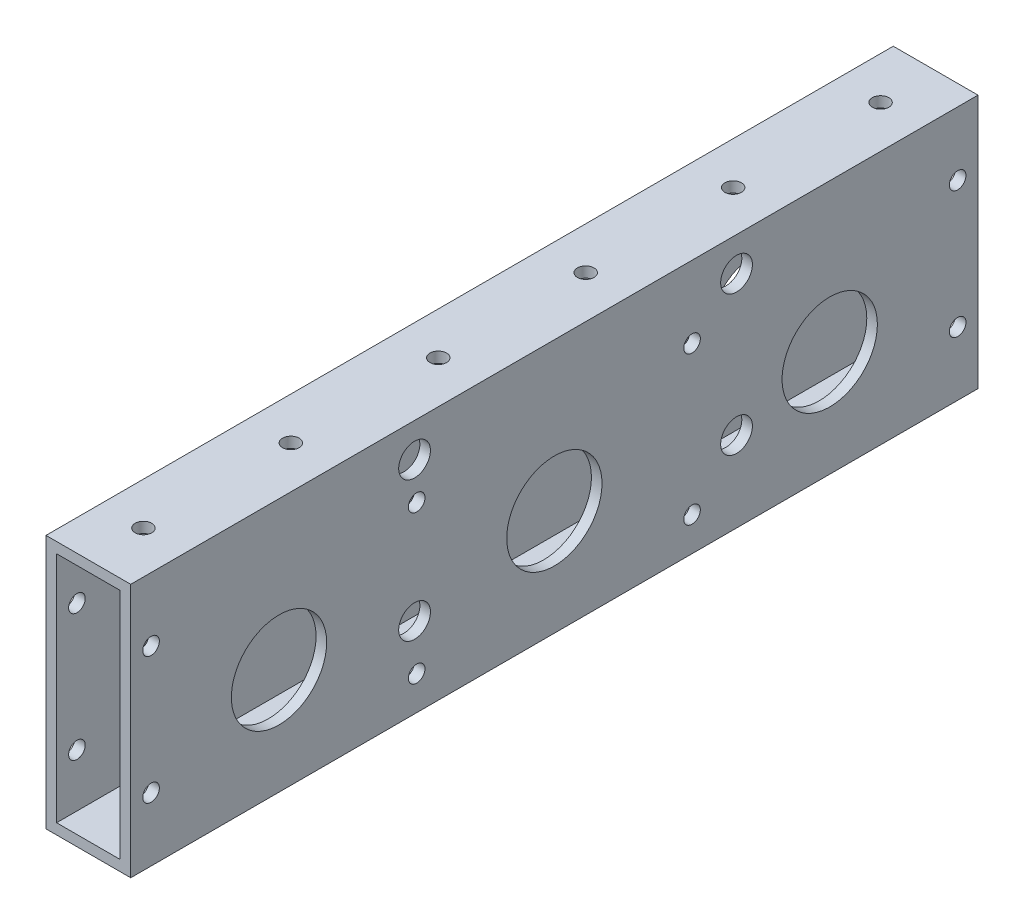
from build123d import *

# Parameters (mm, degrees)
SKETCH1_W                        = 254
SKETCH1_H                        = 76.2
BOSS_EXTRUDE1_DEPTH              = 25.4
SHELL1_T                         = -3.175
SKETCH2_R                        = 14.2875
CUT_EXTRUDE1_DEPTH               = 136.002851822
F_10_CLEARANCE_HOLE1_D           = 4.9784
F_10_CLEARANCE_HOLE2_D           = 4.9784
F_3_8_0_375_DIAMETER_HOLE1_D     = 9.525
F_3_8_0_375_DIAMETER_HOLE1_DEPTH = 12.7
F_3_8_0_375_DIAMETER_HOLE1_TIP   = 2.861598698
F_3_8_0_375_DIAMETER_HOLE2_D     = 9.525
F_3_8_0_375_DIAMETER_HOLE2_DEPTH = 12.7
F_3_8_0_375_DIAMETER_HOLE2_TIP   = 2.861598698
F_10_CLEARANCE_HOLE3_D           = 4.9784
F_10_CLEARANCE_HOLE3_DEPTH       = 12.7
F_10_CLEARANCE_HOLE3_TIP         = 1.495662253
F_10_CLEARANCE_HOLE4_D           = 4.9784
F_10_CLEARANCE_HOLE5_D           = 4.9784


with BuildPart() as part:
    # Sketch1 → Boss-Extrude1 (new body)
    with BuildSketch(Plane(origin=(0, 0, 0), x_dir=(0, 0, -1), z_dir=(1, 0, 0))):
        Rectangle(SKETCH1_W, SKETCH1_H)
    extrude(amount=BOSS_EXTRUDE1_DEPTH)

    # Shell1
    shell1_openings = [part.faces().sort_by_distance(p)[0] for p in [
        (12.7, 0, 127),
        (12.7, 0, -127),
    ]]
    offset(amount=SHELL1_T, openings=shell1_openings, kind=Kind.INTERSECTION)

    # Sketch2 → Cut-Extrude1 (cut, through all)
    with BuildSketch(Plane(origin=(25.4, 0, 0), x_dir=(0, 0, -1), z_dir=(1, 0, 0))):
        with Locations((0, -6.35)):
            Circle(SKETCH2_R)
        with Locations((-82.55, -6.35)):
            Circle(SKETCH2_R)
        with Locations((82.55, -6.35)):
            Circle(SKETCH2_R)
    extrude(amount=-CUT_EXTRUDE1_DEPTH, mode=Mode.SUBTRACT)

    # #10 Clearance Hole1 (through all)
    with Locations(Plane(origin=(25.4, 0, 0), x_dir=(0, 0, -1), z_dir=(1, 0, 0))):
        with Locations((-120.904, 19.05), (-120.904, -19.05)):
            f_10_clearance_hole1 = Hole(F_10_CLEARANCE_HOLE1_D / 2)

    # Mirror1: #10 Clearance Hole1 across plane
    add(f_10_clearance_hole1.mirror(Plane.XY), mode=Mode.SUBTRACT)

    # #10 Clearance Hole2 (through all)
    with Locations(Plane(origin=(25.4, 0, 0), x_dir=(0, 0, -1), z_dir=(1, 0, 0))):
        with Locations((-41.275, -27.94), (41.275, -27.94), (-41.275, 16.51), (41.275, 16.51)):
            Hole(F_10_CLEARANCE_HOLE2_D / 2)

    # 3/8 (0.375) Diameter Hole1
    with Locations(Plane.ZY):
        with Locations((-41.275, -27.94), (41.275, -27.94), (41.275, 16.51), (-41.275, 16.51)):
            Hole(F_3_8_0_375_DIAMETER_HOLE1_D / 2, depth=F_3_8_0_375_DIAMETER_HOLE1_DEPTH)
            with Locations((0, 0, -(F_3_8_0_375_DIAMETER_HOLE1_DEPTH + F_3_8_0_375_DIAMETER_HOLE1_TIP / 2))):  # 118° drill point
                Cone(0, F_3_8_0_375_DIAMETER_HOLE1_D / 2, F_3_8_0_375_DIAMETER_HOLE1_TIP, mode=Mode.SUBTRACT)

    # 3/8 (0.375) Diameter Hole2
    with Locations(Plane(origin=(25.4, 0, 0), x_dir=(0, 0, -1), z_dir=(1, 0, 0))):
        with Locations((-41.91, 27.94), (54.61, 27.94), (54.61, -13.97), (-41.91, -13.97)):
            Hole(F_3_8_0_375_DIAMETER_HOLE2_D / 2, depth=F_3_8_0_375_DIAMETER_HOLE2_DEPTH)
            with Locations((0, 0, -(F_3_8_0_375_DIAMETER_HOLE2_DEPTH + F_3_8_0_375_DIAMETER_HOLE2_TIP / 2))):  # 118° drill point
                Cone(0, F_3_8_0_375_DIAMETER_HOLE2_D / 2, F_3_8_0_375_DIAMETER_HOLE2_TIP, mode=Mode.SUBTRACT)

    # #10 Clearance Hole3
    with Locations(Plane.ZY):
        with Locations((41.91, 27.94), (-54.61, 27.94), (-54.61, -13.97), (41.91, -13.97)):
            Hole(F_10_CLEARANCE_HOLE3_D / 2, depth=F_10_CLEARANCE_HOLE3_DEPTH)
            with Locations((0, 0, -(F_10_CLEARANCE_HOLE3_DEPTH + F_10_CLEARANCE_HOLE3_TIP / 2))):  # 118° drill point
                Cone(0, F_10_CLEARANCE_HOLE3_D / 2, F_10_CLEARANCE_HOLE3_TIP, mode=Mode.SUBTRACT)

    # #10 Clearance Hole4 (through all)
    with Locations(Plane(origin=(0, -38.1, 0), x_dir=(-1, 0, 0), z_dir=(0, -1, 0))):
        with Locations((-12.7, -110.49), (-12.7, 110.49)):
            Hole(F_10_CLEARANCE_HOLE4_D / 2)

    # #10 Clearance Hole5 (through all)
    with Locations(Plane(origin=(0, 38.1, 0), x_dir=(1, 0, 0), z_dir=(0, 1, 0))):
        with Locations((12.7, 66.294), (12.7, 22.098)):
            f_10_clearance_hole5 = Hole(F_10_CLEARANCE_HOLE5_D / 2)

    # Mirror2: #10 Clearance Hole5 across plane
    add(f_10_clearance_hole5.mirror(Plane.XY), mode=Mode.SUBTRACT)


solid = part.part
